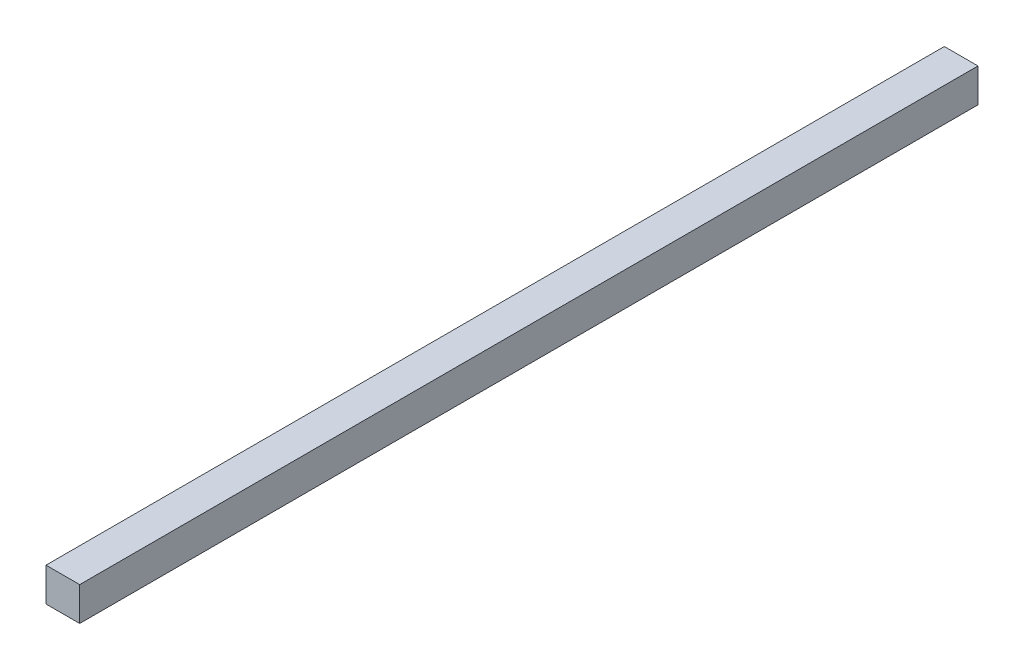
from build123d import *

# Parameters (mm, degrees)
SKETCH_1_W      = 15
SKETCH_1_H      = 15
EXTRUDE_1_DEPTH = 400


with BuildPart() as part:
    # 草图1 → 凸台-拉伸1 (new body)
    with BuildSketch(Plane.XY):
        Rectangle(SKETCH_1_W, SKETCH_1_H)
    extrude(amount=EXTRUDE_1_DEPTH)


solid = part.part
